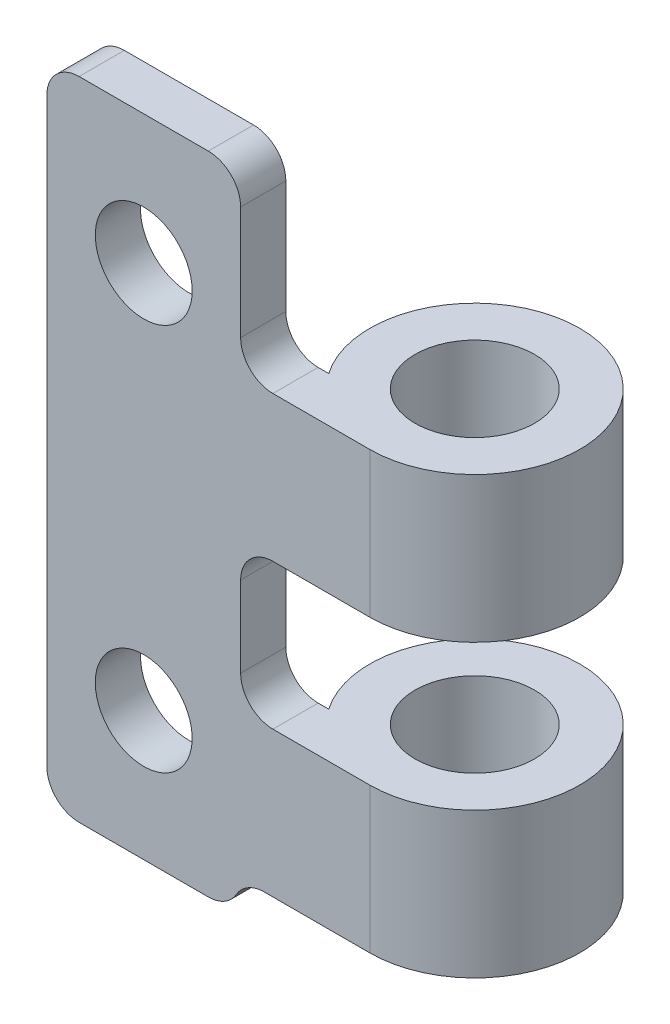
from build123d import *

# Parameters (mm, degrees)
SKETCH_1_R      = 1.5
EXTRUDE_1_DEPTH = 1.4
SKETCH_4_W      = 4
SKETCH_4_H      = 1.4
EXTRUDE_2_DEPTH = 4.5
SKETCH_5_R      = 3.25
SKETCH_5_R_2    = 1.85
EXTRUDE_3_DEPTH = 4.5
FILLET_1_R      = 1


with BuildPart() as part:
    # 草图1 → 凸台-拉伸1 (new body)
    with BuildSketch(Plane.XY):
        with BuildLine():
            Line((-2, -10), (2, -10))
            ThreePointArc((2, -10), (2.707106781, -9.707106781), (3, -9))
            Line((3, -9), (3, 9))
            ThreePointArc((3, 9), (2.707106781, 9.707106781), (2, 10))
            Line((2, 10), (-2, 10))
            ThreePointArc((-2, 10), (-2.707106781, 9.707106781), (-3, 9))
            Line((-3, 9), (-3, -9))
            ThreePointArc((-3, -9), (-2.707106781, -9.707106781), (-2, -10))
        make_face()
        with Locations((0, 6)):
            Circle(SKETCH_1_R, mode=Mode.SUBTRACT)
        with Locations(Location((0, -6, 0), (0, 0, 180))):
            Circle(SKETCH_1_R, mode=Mode.SUBTRACT)
    extrude(amount=EXTRUDE_1_DEPTH)

    # 草图4 → 凸台-拉伸2 (add)
    with BuildSketch(Plane(origin=(0, -9, 0), x_dir=(-1, 0, 0), z_dir=(0, -1, 0))):
        with Locations((-5, -0.7)):
            Rectangle(SKETCH_4_W, SKETCH_4_H)
    extrude_2 = extrude(amount=-EXTRUDE_2_DEPTH)

    # 草图5 → 凸台-拉伸3 (add)
    with BuildSketch(Plane.XZ.offset(9)):
        with Locations((7, -1.85)):
            Circle(SKETCH_5_R)
        with Locations(Location((7, -1.85, 0), (0, 0, 270))):
            Circle(SKETCH_5_R_2, mode=Mode.SUBTRACT)
    extrude_3 = extrude(amount=-EXTRUDE_3_DEPTH)

    # 镜向1: 凸台-拉伸2, 凸台-拉伸3 across plane
    add(extrude_2.mirror(Plane.ZX.offset(-2.25)))
    add(extrude_3.mirror(Plane.ZX.offset(-2.25)))

    # 圆角1
    fillet_1_edges = [part.edges().sort_by_distance(p)[0] for p in [
        (3, -9, 0.7),
        (3, -4.5, 0.7),
        (3, 4.5, 0.7),
        (3, 0, 0.7),
    ]]
    fillet(fillet_1_edges, radius=FILLET_1_R)


solid = part.part
